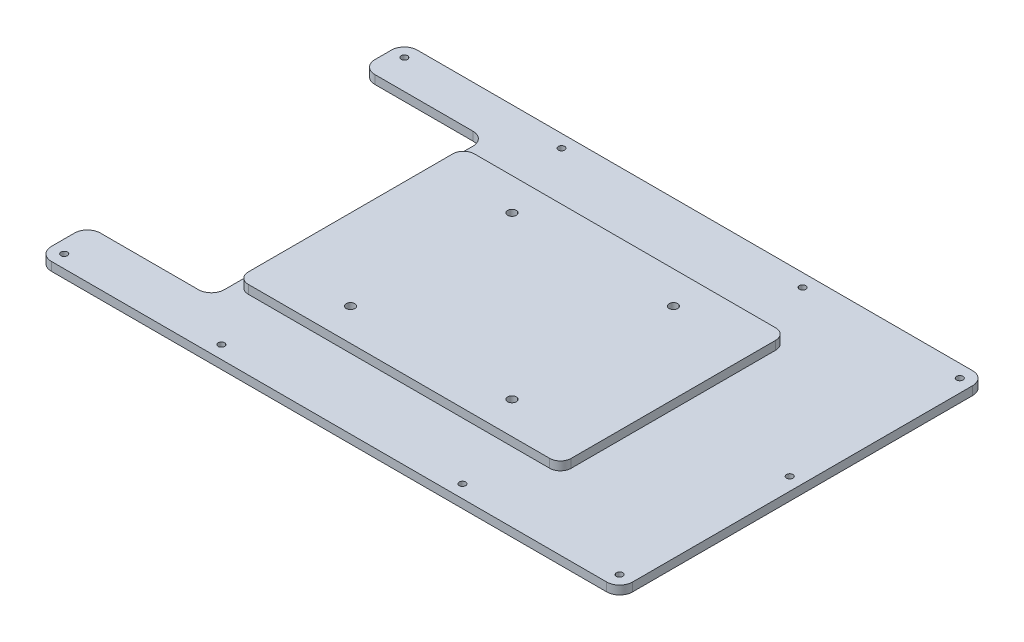
from build123d import *

# Parameters (mm, degrees)
SKETCH_1_W               = 150
SKETCH_1_H               = 105
SKETCH_1_R               = 2
EXTRUDE_1_DEPTH          = 4
SKETCH_2_W               = 270
SKETCH_2_H               = 170
EXTRUDE_2_DEPTH          = 4
CUT_EXTRUDE_2_DEPTH      = 193.860701025
CUT_EXTRUDE_2_DEPTH_BACK = 193.860701025
SKETCH_3_R               = 2
FILLET_1_R               = 6
CUT_EXTRUDE_3_DEPTH      = 193.736218703
CUT_EXTRUDE_3_DEPTH_BACK = 193.736218703
SKETCH_4_R               = 1.5
CUT_EXTRUDE_4_DEPTH      = 193.736218703
CUT_EXTRUDE_4_DEPTH_BACK = 193.736218703
SKETCH_5_W               = 57.583887605
SKETCH_5_H               = 127.518164053
FILLET_2_R               = 6
FILLET_3_R               = 5


with BuildPart() as part:
    # 草图1 → 凸台-拉伸1 (new body)
    with BuildSketch(Plane(origin=(0, 0, 0), x_dir=(1, 0, 0), z_dir=(0, 1, 0))):
        with Locations((0, 52.5)):
            Rectangle(SKETCH_1_W, SKETCH_1_H)
        with Locations(Location((-37.5, 90, 0), (0, 0, 270))):
            Circle(SKETCH_1_R, mode=Mode.SUBTRACT)
        with Locations(Location((-37.5, 15, 0), (0, 0, 270))):
            Circle(SKETCH_1_R, mode=Mode.SUBTRACT)
        with Locations(Location((37.5, 15, 0), (0, 0, 270))):
            Circle(SKETCH_1_R, mode=Mode.SUBTRACT)
        with Locations(Location((37.5, 90, 0), (0, 0, 270))):
            Circle(SKETCH_1_R, mode=Mode.SUBTRACT)
    extrude(amount=EXTRUDE_1_DEPTH)

    # 草图2 → 凸台-拉伸2 (add)
    with BuildSketch(Plane.XZ):
        with Locations((0, -52.5)):
            Rectangle(SKETCH_2_W, SKETCH_2_H)
    extrude(amount=EXTRUDE_2_DEPTH)

    # 草图3 → 切除-拉伸2 (cut, two sides: drawn at the far end of the back side and taken through both)
    with BuildSketch(Plane(origin=(0, 4, 0), x_dir=(1, 0, 0), z_dir=(0, 1, 0)).offset(-CUT_EXTRUDE_2_DEPTH_BACK)):
        with Locations(Location((-37.5, 90, 0), (0, 0, 270))):
            Circle(SKETCH_3_R)
        with Locations(Location((37.5, 90, 0), (0, 0, 270))):
            Circle(SKETCH_3_R)
        with Locations(Location((-37.5, 15, 0), (0, 0, 270))):
            Circle(SKETCH_3_R)
        with Locations(Location((37.5, 15, 0), (0, 0, 270))):
            Circle(SKETCH_3_R)
    extrude(amount=CUT_EXTRUDE_2_DEPTH + CUT_EXTRUDE_2_DEPTH_BACK, mode=Mode.SUBTRACT)

    # 圆角1
    fillet_1_edges = [part.edges().sort_by_distance(p)[0] for p in [
        (135, -2, -137.5),
        (135, -2, 32.5),
        (-135, -2, 32.5),
        (-135, -2, -137.5),
    ]]
    fillet(fillet_1_edges, radius=FILLET_1_R)

    # 草图4 → 切除-拉伸3 (cut, two sides: drawn at the far end of the back side and taken through both)
    with BuildSketch(Plane(origin=(0, 0, 0), x_dir=(1, 0, 0), z_dir=(0, 1, 0)).offset(-CUT_EXTRUDE_3_DEPTH_BACK)):
        with Locations(Location((-129, 52.5, 0), (0, 0, 270))):
            Circle(SKETCH_4_R)
        with Locations(Location((-129, -26.5, 0), (0, 0, 270))):
            Circle(SKETCH_4_R)
        with Locations(Location((-56, -26.5, 0), (0, 0, 270))):
            Circle(SKETCH_4_R)
        with Locations(Location((56, -26.5, 0), (0, 0, 270))):
            Circle(SKETCH_4_R)
        with Locations(Location((129, -26.5, 0), (0, 0, 270))):
            Circle(SKETCH_4_R)
        with Locations(Location((129, 52.5, 0), (0, 0, 270))):
            Circle(SKETCH_4_R)
        with Locations(Location((56, 131.5, 0), (0, 0, 270))):
            Circle(SKETCH_4_R)
        with Locations(Location((129, 131.5, 0), (0, 0, 270))):
            Circle(SKETCH_4_R)
        with Locations(Location((-56, 131.5, 0), (0, 0, 270))):
            Circle(SKETCH_4_R)
        with Locations(Location((-129, 131.5, 0), (0, 0, 270))):
            Circle(SKETCH_4_R)
    extrude(amount=CUT_EXTRUDE_3_DEPTH + CUT_EXTRUDE_3_DEPTH_BACK, mode=Mode.SUBTRACT)

    # 草图5 → 切除-拉伸4 (cut, two sides: drawn at the far end of the back side and taken through both)
    with BuildSketch(Plane(origin=(0, 0, 0), x_dir=(1, 0, 0), z_dir=(0, 1, 0)).offset(-CUT_EXTRUDE_4_DEPTH_BACK)):
        with Locations((-106.208056197, 54.041877238)):
            Rectangle(SKETCH_5_W, SKETCH_5_H)
    extrude(amount=CUT_EXTRUDE_4_DEPTH + CUT_EXTRUDE_4_DEPTH_BACK, mode=Mode.SUBTRACT)

    # 圆角2
    fillet_2_edges = [part.edges().sort_by_distance(p)[0] for p in [
        (-135, -2, 9.717204788),
        (-77.416112395, -2, -117.800959265),
        (-135, -2, -117.800959265),
        (-77.416112395, -2, 9.717204788),
    ]]
    fillet(fillet_2_edges, radius=FILLET_2_R)

    # 圆角3
    fillet_3_edges = [part.edges().sort_by_distance(p)[0] for p in [
        (-75, 2, -105),
        (75, 2, -105),
        (75, 2, 0),
        (-75, 2, 0),
    ]]
    fillet(fillet_3_edges, radius=FILLET_3_R)


solid = part.part
